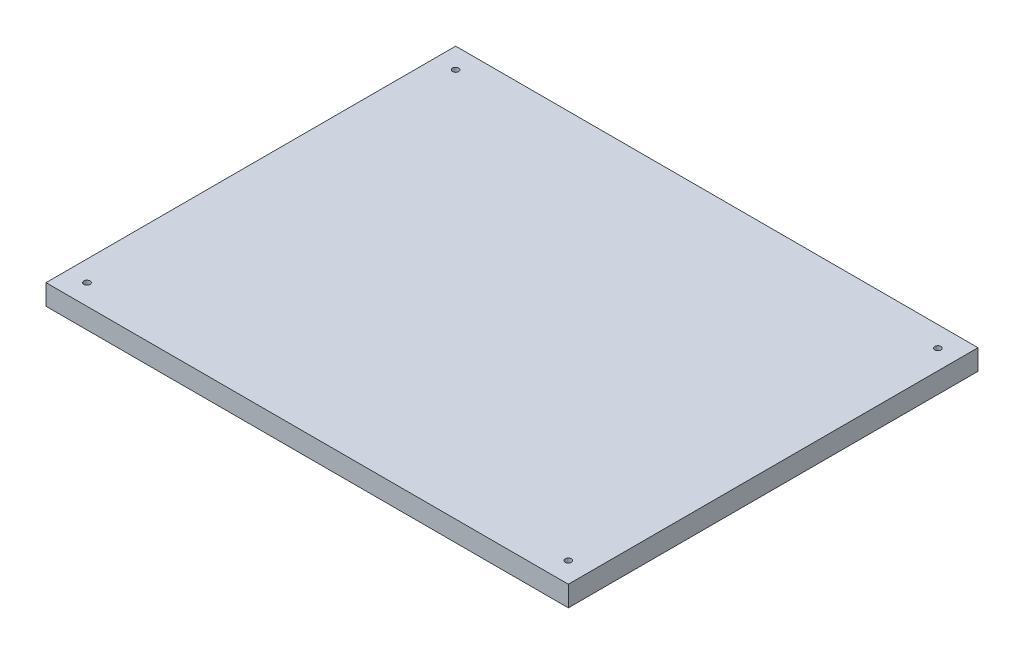
from build123d import *

# Parameters (mm, degrees)
ESBO_O1_W                = 255
ESBO_O1_H                = 200
RESSALTO_EXTRUS_O1_DEPTH = 10
CUT_EXTRUDE2_DEPTH       = 26
CUT_EXTRUDE2_DEPTH_BACK  = 10
SKETCH1_R                = 1.5


with BuildPart() as part:
    # Esboço1 → Ressalto-extrusão1 (new body)
    with BuildSketch(Plane(origin=(0, 0, 0), x_dir=(1, 0, 0), z_dir=(0, 1, 0))):
        Rectangle(ESBO_O1_W, ESBO_O1_H)
    extrude(amount=RESSALTO_EXTRUS_O1_DEPTH)

    # Sketch1 → Cut-Extrude2 (cut, two sides: drawn at the far end of the back side and taken through both)
    with BuildSketch(Plane(origin=(0, 0, 0), x_dir=(1, 0, 0), z_dir=(0, 1, 0)).offset(-CUT_EXTRUDE2_DEPTH_BACK)):
        with Locations(Location((-117.5, 90, 0), (0, 0, 90))):
            Circle(SKETCH1_R)
        with Locations(Location((117.904272166, 90, 0), (0, 0, 90))):
            Circle(SKETCH1_R)
        with Locations(Location((117.5, -90, 0), (0, 0, 90))):
            Circle(SKETCH1_R)
        with Locations(Location((-117.5, -90, 0), (0, 0, 90))):
            Circle(SKETCH1_R)
    extrude(amount=CUT_EXTRUDE2_DEPTH + CUT_EXTRUDE2_DEPTH_BACK, mode=Mode.SUBTRACT)


solid = part.part
